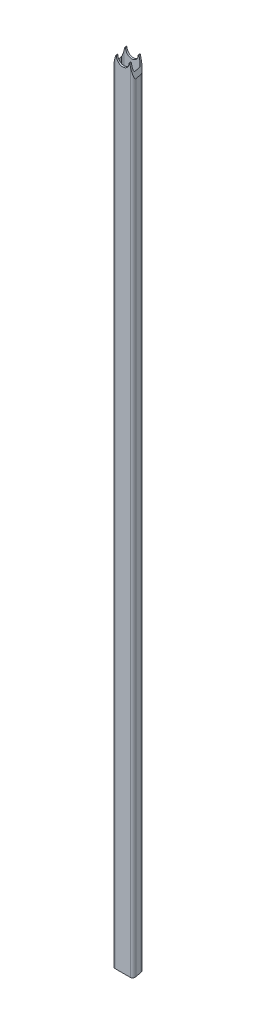
from build123d import *

# Parameters (mm, degrees)
EXTRUDE_1_DEPTH     = 1130
CUT_EXTRUDE_1_DEPTH = 40


with BuildPart() as part:
    # Эскиз1 → Вытянуть-Тонкостенный1 (new body)
    with BuildSketch(Plane(origin=(0, 0, 0), x_dir=(1, 0, 0), z_dir=(0, 1, 0))):
        with BuildLine():
            Line((-11, 7.5), (11, 7.5))
            ThreePointArc((11, 7.5), (13.828427125, 6.328427125), (15, 3.5))
            Line((15, 3.5), (15, -3.5))
            ThreePointArc((15, -3.5), (13.828427125, -6.328427125), (11, -7.5))
            Line((11, -7.5), (-11, -7.5))
            ThreePointArc((-11, -7.5), (-13.828427125, -6.328427125), (-15, -3.5))
            Line((-15, -3.5), (-15, 3.5))
            ThreePointArc((-15, 3.5), (-13.828427125, 6.328427125), (-11, 7.5))
        make_face()
        with BuildLine():
            Line((-11, 5.5), (11, 5.5))
            ThreePointArc((11, 5.5), (12.414213562, 4.914213562), (13, 3.5))
            Line((13, 3.5), (13, -3.5))
            ThreePointArc((13, -3.5), (12.414213562, -4.914213562), (11, -5.5))
            Line((11, -5.5), (-11, -5.5))
            ThreePointArc((-11, -5.5), (-12.414213562, -4.914213562), (-13, -3.5))
            Line((-13, -3.5), (-13, 3.5))
            ThreePointArc((-13, 3.5), (-12.414213562, 4.914213562), (-11, 5.5))
        make_face(mode=Mode.SUBTRACT)
    extrude(amount=EXTRUDE_1_DEPTH)

    # Surface Cut 2
    split(bisect_by=Plane(origin=(0, 1052.429353138, 281.997595264), x_dir=(-1, 0, 0), z_dir=(0, 0.9659258262890681, 0.25881904510252135)), keep=Keep.BOTTOM)

    # Эскиз4 → Вырез-Вытянуть1 (cut)
    with BuildSketch(Plane(origin=(0, 77.570646862, -289.497595264), x_dir=(-1, 0, 0), z_dir=(0, 0.25881904510252135, -0.9659258262890681))):
        with BuildLine():
            Line((-9, 1089.555040868), (-10, 1089.555040868))
            Line((-10, 1089.555040868), (-20, 1052.234532793))
            Line((-20, 1052.234532793), (-20, 1094.555040868))
            Line((-20, 1094.555040868), (20, 1094.555040868))
            Line((20, 1094.555040868), (20, 1052.234532793))
            Line((20, 1052.234532793), (10, 1089.555040868))
            Line((10, 1089.555040868), (9, 1089.555040868))
            ThreePointArc((9, 1089.555040868), (0, 1080.555040868), (-9, 1089.555040868))
        make_face()
    extrude(amount=-CUT_EXTRUDE_1_DEPTH, mode=Mode.SUBTRACT)

    # Surface Cut 3
    split(bisect_by=Plane(origin=(0, 1.875, 0.502404736), x_dir=(1, 0, 0), z_dir=(0, 0.9659258262890691, 0.25881904510251796)), keep=Keep.TOP)


solid = part.part
